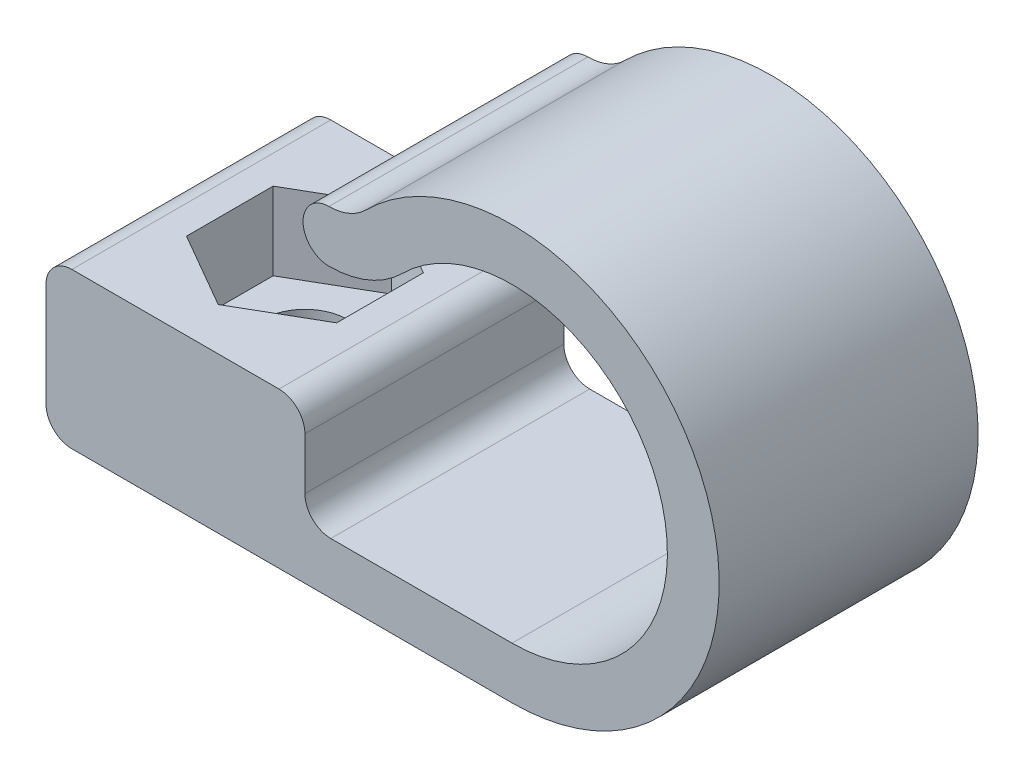
from build123d import *

# Parameters (mm, degrees)
BOSS_EXTRUDE1_DEPTH = 10
CUT_EXTRUDE1_DEPTH  = 3
SKETCH3_R           = 1.65
CUT_EXTRUDE2_DEPTH  = 6


with BuildPart() as part:
    # Sketch1 → Boss-Extrude1 (new body)
    with BuildSketch(Plane.XY):
        with BuildLine():
            Line((0, 1), (0, 5))
            ThreePointArc((0, 5), (0.292893219, 5.707106781), (1, 6))
            Line((1, 6), (9, 6))
            ThreePointArc((9, 6), (9.707106781, 5.707106781), (10, 5))
            Line((10, 5), (10, 3))
            ThreePointArc((10, 3), (10.292893219, 2.292893219), (11, 2))
            Line((11, 2), (18, 2))
            ThreePointArc((18, 2), (23.543277195, 10.296100594), (13.757359313, 12.242640687))
            ThreePointArc((13.757359313, 12.242640687), (12.459665918, 11.375549682), (10.928932188, 11.071067812))
            ThreePointArc((10.928932188, 11.071067812), (9.928932188, 12.071067812), (10.928932188, 13.071067812))
            ThreePointArc((10.928932188, 13.071067812), (11.694299053, 13.223308747), (12.343145751, 13.656854249))
            ThreePointArc((12.343145751, 13.656854249), (25.39103626, 11.061467459), (18, 0))
            Line((18, 0), (1, 0))
            ThreePointArc((1, 0), (0.292893219, 0.292893219), (0, 1))
        make_face()
    extrude(amount=BOSS_EXTRUDE1_DEPTH)

    # Sketch2 → Cut-Extrude1 (cut)
    with BuildSketch(Plane(origin=(0, 6, 0), x_dir=(1, 0, 0), z_dir=(0, 1, 0))):
        Polygon((5, -1.651368439), (2.1, -3.325684219), (2.1, -6.674315781), (5, -8.348631561), (7.9, -6.674315781), (7.9, -3.325684219), align=None)
    extrude(amount=-CUT_EXTRUDE1_DEPTH, mode=Mode.SUBTRACT)

    # Sketch3 → Cut-Extrude2 (cut)
    with BuildSketch(Plane(origin=(0, 6, 0), x_dir=(1, 0, 0), z_dir=(0, 1, 0))):
        with Locations(Location((5, -5, 0), (0, 0, 270))):
            Circle(SKETCH3_R)
    extrude(amount=-CUT_EXTRUDE2_DEPTH, mode=Mode.SUBTRACT)


solid = part.part
